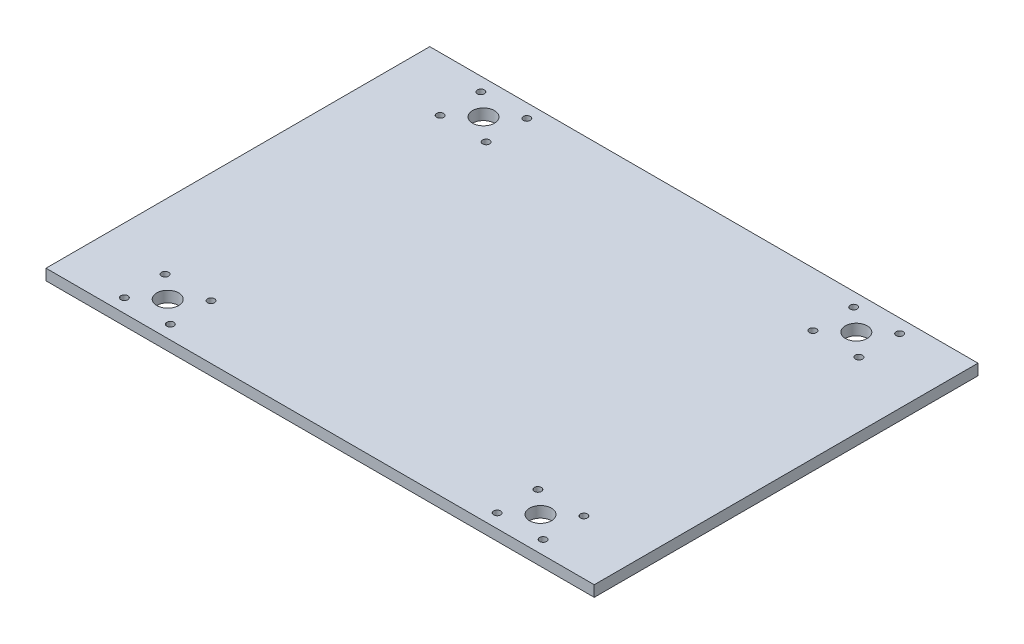
from build123d import *

# Parameters (mm, degrees)
BOSS_EXTRU_1_DEPTH          = 5
ESQUISSE2_R                 = 5
ESQUISSE2_R_2               = 1.6
ENL_V_MAT_EXTRU_4_DEPTH     = 10
SYM_TRIE2_COPY_1_SKETCH_R   = 5
SYM_TRIE2_COPY_1_SKETCH_R_2 = 1.6
SYM_TRIE2_COPY_1_DEPTH      = 10


with BuildPart() as part:
    # Esquisse1 → Boss.-Extru.1 (new body)
    with BuildSketch(Plane(origin=(0, 0, 0), x_dir=(1, 0, 0), z_dir=(0, 1, 0))):
        Polygon((45, 87.5), (-70, 87.5), (-125, 87.5), (-125, 67.5), (-125, -67.5), (-125, -87.5), (-70, -87.5), (45, -87.5), (125, -87.5), (125, -42.5), (125, 42.5), (125, 87.5), align=None)
    extrude(amount=BOSS_EXTRU_1_DEPTH)

    # Esquisse2 → Enlèv. mat.-Extru.4 (cut)
    with BuildSketch(Plane(origin=(0, 5, 0), x_dir=(1, 0, 0), z_dir=(0, 1, 0))):
        with Locations(Location((85, -72, 0), (0, 0, 270))):
            Circle(ESQUISSE2_R)
        with Locations(Location((74.519765478, -62.717506566, 0), (0, 0, 270))):
            Circle(ESQUISSE2_R_2)
        with Locations(Location((74.519765478, -81.282493434, 0), (0, 0, 270))):
            Circle(ESQUISSE2_R_2)
        with Locations(Location((95.480234522, -81.282493434, 0), (0, 0, 270))):
            Circle(ESQUISSE2_R_2)
        with Locations(Location((95.480234522, -62.717506566, 0), (0, 0, 270))):
            Circle(ESQUISSE2_R_2)
    enl_v_mat_extru_4 = extrude(amount=-ENL_V_MAT_EXTRU_4_DEPTH, mode=Mode.SUBTRACT)

    # Symétrie1: Enlèv. mat.-Extru.4 across plane
    add(enl_v_mat_extru_4.mirror(Plane.XY), mode=Mode.SUBTRACT)

    # Symétrie2: Enlèv. mat.-Extru.4 across plane
    add(enl_v_mat_extru_4.mirror(Plane(origin=(0, 0, 0), x_dir=(0, 0, 1), z_dir=(1, 0, 0))), mode=Mode.SUBTRACT)

    # Symétrie2 copy 1 sketch → Symétrie2 copy 1 (cut)
    with BuildSketch(Plane(origin=(0, 5, 0), x_dir=(-1, 0, 0), z_dir=(0, 1, 0))):
        with Locations(Location((85, -72, 0), (0, 0, 270))):
            Circle(SYM_TRIE2_COPY_1_SKETCH_R)
        with Locations(Location((74.519765478, -62.717506566, 0), (0, 0, 270))):
            Circle(SYM_TRIE2_COPY_1_SKETCH_R_2)
        with Locations(Location((74.519765478, -81.282493434, 0), (0, 0, 270))):
            Circle(SYM_TRIE2_COPY_1_SKETCH_R_2)
        with Locations(Location((95.480234522, -81.282493434, 0), (0, 0, 270))):
            Circle(SYM_TRIE2_COPY_1_SKETCH_R_2)
        with Locations(Location((95.480234522, -62.717506566, 0), (0, 0, 270))):
            Circle(SYM_TRIE2_COPY_1_SKETCH_R_2)
    extrude(amount=-SYM_TRIE2_COPY_1_DEPTH, mode=Mode.SUBTRACT)


solid = part.part
